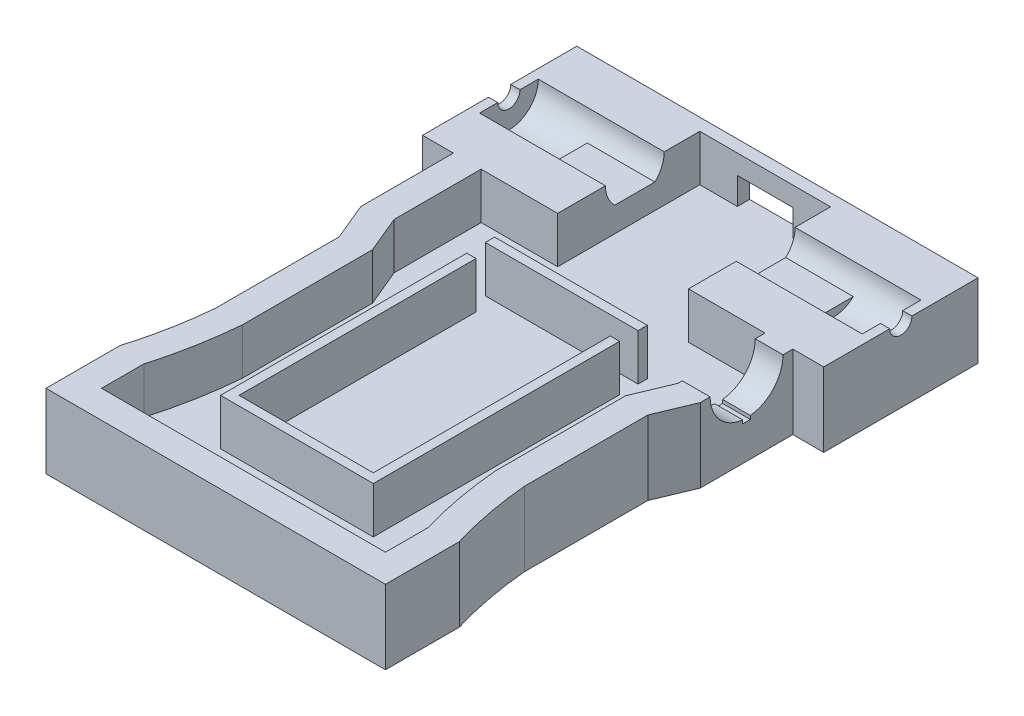
from build123d import *

# Parameters (mm, degrees)
BOSS_EXTRUDE1_DEPTH = 20.32
CUT_EXTRUDE1_DEPTH  = 12.7
SKETCH14_R          = 8.0645
CUT_EXTRUDE4_DEPTH  = 16.002
CUT_EXTRUDE5_DEPTH  = 34.544
SKETCH14_5_R        = 3.048
CUT_EXTRUDE6_DEPTH  = 157.413445344
SKETCH15_W          = 35.898582
SKETCH15_H          = 38.980588406
CUT_EXTRUDE7_DEPTH  = 17.78
SKETCH16_W          = 41.91
SKETCH16_H          = 2.54
BOSS_EXTRUDE2_DEPTH = 12.7
CUT_EXTRUDE9_DEPTH  = 11.4
SKETCH17_5_R        = 10
CUT_EXTRUDE10_DEPTH = 11.4
CUT_EXTRUDE16_DEPTH = 10
SKETCH25_W          = 35.898582
SKETCH25_H          = 38.980588406
BOSS_EXTRUDE4_DEPTH = 5.08


with BuildPart() as part:
    # Sketch3 → Boss-Extrude1 (new body)
    with BuildSketch(Plane(origin=(0, 0, 0), x_dir=(1, 0, 0), z_dir=(0, 1, 0))):
        with BuildLine():
            Line((101.599873, 0), (110.066582, 0))
            Line((110.066582, 0), (110.066582, 42.333418))
            Line((110.066582, 42.333418), (55.033291, 42.333418))
            Line((55.033291, 42.333418), (8.4666328, 42.333418))
            Line((8.4666328, 42.333418), (0, 42.333418))
            Line((0, 42.333418), (0, 0))
            Line((0, 0), (8.4666328, 0))
            Line((8.4666328, 0), (8.4666328, -25.4))
            Line((8.4666328, -25.4), (12.6999492, -35.56))
            Line((12.6999492, -35.56), (12.6999492, -69.426582))
            add(Edge.make_bspline(
                [(12.6999492, -69.426582), (11.690404189, -80.766544706), (8.46666328, -91.44)],
                knots=[0, 0, 0, 0.504540069, 0.504540069, 0.504540069], degree=2))
            Line((8.46666328, -91.44), (8.46666328, -111.76))
            Line((8.46666328, -111.76), (101.599995682, -111.76))
            Line((101.599995682, -111.76), (101.599995682, -91.44))
            add(Edge.make_bspline(
                [(97.366709, -69.426582), (98.376270675, -80.766537876), (101.599995682, -91.44)],
                knots=[0, 0, 0, 0.504540407, 0.504540407, 0.504540407], degree=2))
            Line((97.366709, -69.426582), (97.366709, -35.56))
            Line((97.366709, -35.56), (101.599873, -25.4))
            Line((101.599873, -25.4), (101.599873, 0))
        make_face()
    extrude(amount=BOSS_EXTRUDE1_DEPTH)

    # Sketch7 → Cut-Extrude1 (cut)
    with BuildSketch(Plane(origin=(0, 20.32, 0), x_dir=(1, 0, 0), z_dir=(0, 1, 0))):
        with BuildLine():
            Line((16.0866328, 0), (93.979873, 0))
            Line((93.979873, 0), (93.979873, -23.876056271))
            Line((93.979873, -23.876056271), (89.746709, -34.036056271))
            Line((89.746709, -34.036056271), (89.746709, -69.759644388))
            add(Edge.make_bspline(
                [(89.746709, -69.759644388), (90.418698914, -77.556217584), (91.829471112, -85.161374913), (93.979995682, -92.545959033)],
                knots=[0, 0, 0, 0, 1, 1, 1, 1], degree=3))
            Line((93.979995682, -92.545959033), (93.979995682, -104.14))
            Line((93.979995682, -104.14), (16.08666328, -104.14))
            Line((16.08666328, -104.14), (16.08666328, -92.545964634))
            add(Edge.make_bspline(
                [(16.08666328, -92.545964634), (18.237198531, -85.161380775), (19.647970427, -77.556219246), (20.3199492, -69.759638641)],
                knots=[0, 0, 0, 0, 1, 1, 1, 1], degree=3))
            Line((20.3199492, -69.759638641), (20.3199492, -34.036005627))
            Line((20.3199492, -34.036005627), (16.0866328, -23.876005627))
            Line((16.0866328, -23.876005627), (16.0866328, 0))
        make_face()
    extrude(amount=-CUT_EXTRUDE1_DEPTH, mode=Mode.SUBTRACT)

    # Sketch14 → Cut-Extrude4 (cut)
    with BuildSketch(Plane.ZY.offset(-2.54)):
        with Locations((-21.166709, 20.32)):
            Circle(SKETCH14_R)
    cut_extrude4 = extrude(amount=-CUT_EXTRUDE4_DEPTH, mode=Mode.SUBTRACT)

    # Sketch14<4> → Cut-Extrude5 (cut)
    with BuildSketch(Plane.ZY.offset(-2.54)):
        with BuildLine():
            Line((-26.672257875, 14.4272), (-15.661160125, 14.4272))
            ThreePointArc((-15.661160125, 14.4272), (-21.166709, 28.3845), (-26.672257875, 14.4272))
        make_face()
    cut_extrude5 = extrude(amount=-CUT_EXTRUDE5_DEPTH, mode=Mode.SUBTRACT)

    # Sketch14<5> → Cut-Extrude6 (cut, through all)
    with BuildSketch(Plane.ZY.offset(-2.54)):
        with Locations((-21.166709, 20.32)):
            Circle(SKETCH14_5_R)
    cut_extrude6 = extrude(amount=CUT_EXTRUDE6_DEPTH, mode=Mode.SUBTRACT)

    # Mirror2: Cut-Extrude4, Cut-Extrude5, Cut-Extrude6 across plane
    add(cut_extrude4.mirror(Plane(origin=(55.033291, 0, 0), x_dir=(0, 0, 1), z_dir=(1, 0, 0))), mode=Mode.SUBTRACT)
    add(cut_extrude5.mirror(Plane(origin=(55.033291, 0, 0), x_dir=(0, 0, 1), z_dir=(1, 0, 0))), mode=Mode.SUBTRACT)
    add(cut_extrude6.mirror(Plane(origin=(55.033291, 0, 0), x_dir=(0, 0, 1), z_dir=(1, 0, 0))), mode=Mode.SUBTRACT)

    # Sketch15 → Cut-Extrude7 (cut)
    with BuildSketch(Plane(origin=(0, 20.32, 0), x_dir=(1, 0, 0), z_dir=(0, 1, 0))):
        with Locations((55.033291, 19.490294203)):
            Rectangle(SKETCH15_W, SKETCH15_H)
    extrude(amount=-CUT_EXTRUDE7_DEPTH, mode=Mode.SUBTRACT)

    # Sketch16 → Boss-Extrude2 (add)
    with BuildSketch(Plane(origin=(0, 7.62, 0), x_dir=(1, 0, 0), z_dir=(0, 1, 0))):
        with Locations((55.0333291, -15.57585033)):
            Rectangle(SKETCH16_W, SKETCH16_H)
        Polygon((75.9883291, -21.92585033), (73.4483291, -21.92585033), (73.4483291, -86.94985033), (36.6183291, -86.94985033), (36.6183291, -21.92585033), (34.0783291, -21.92585033), (34.0783291, -89.48985033), (75.9883291, -89.48985033), align=None)
    extrude(amount=BOSS_EXTRUDE2_DEPTH)

    # Sketch17 → Cut-Extrude9 (cut)
    with BuildSketch(Plane(origin=(104.139873, 0, 0), x_dir=(0, 0, -1), z_dir=(1, 0, 0))):
        with BuildLine():
            Line((-13.75, 9.42), (-12.7, 9.42))
            Line((-12.7, 9.42), (-11.65, 9.42))
            Line((-11.65, 9.42), (-11.65, 10.375277782))
            ThreePointArc((-11.65, 10.375277782), (-12.7, 10.32), (-13.75, 10.375277782))
            Line((-13.75, 10.375277782), (-13.75, 9.42))
        make_face()
    extrude(amount=-CUT_EXTRUDE9_DEPTH, mode=Mode.SUBTRACT)

    # Sketch17<5> → Cut-Extrude10 (cut)
    with BuildSketch(Plane(origin=(104.139873, 0, 0), x_dir=(0, 0, -1), z_dir=(1, 0, 0))):
        with Locations((-12.7, 20.32)):
            Circle(SKETCH17_5_R)
    extrude(amount=-CUT_EXTRUDE10_DEPTH, mode=Mode.SUBTRACT)

    # Sketch23 → Cut-Extrude16 (cut)
    with BuildSketch(Plane.XY.offset(-38.980588406)):
        Polygon((62.653291, 14.986), (62.653291, 7.62), (55.033291, 7.62), (47.413291, 7.62), (47.413291, 14.986), align=None)
    extrude(amount=-CUT_EXTRUDE16_DEPTH, mode=Mode.SUBTRACT)

    # Sketch25 → Boss-Extrude4 (add)
    with BuildSketch(Plane(origin=(0, 2.54, 0), x_dir=(1, 0, 0), z_dir=(0, 1, 0))):
        with Locations((55.033291, 19.490294203)):
            Rectangle(SKETCH25_W, SKETCH25_H)
    extrude(amount=BOSS_EXTRUDE4_DEPTH)


solid = part.part
